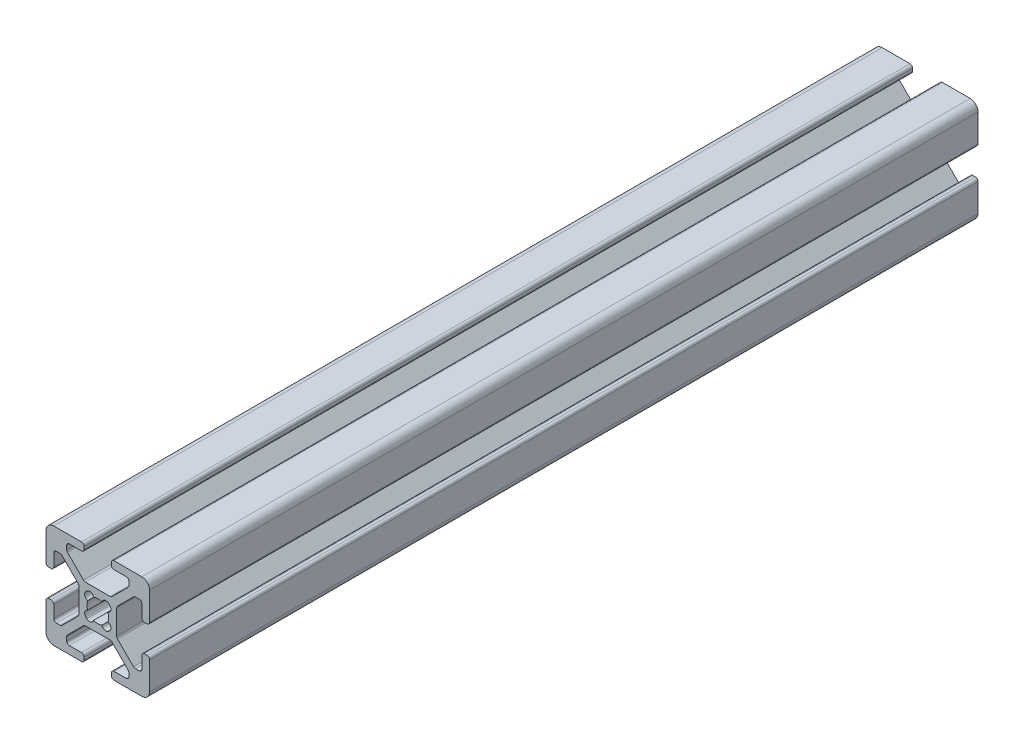
from build123d import *

# Parameters (mm, degrees)
BOSS_EXTRUDE1_DEPTH = 160


with BuildPart() as part:
    # Sketch1 → Boss-Extrude1 (new body)
    with BuildSketch(Plane(origin=(0, 0, -160), x_dir=(-1, 0, 0), z_dir=(0, 0, -1))):
        with BuildLine():
            Line((10, -8.5), (10, -3.138))
            ThreePointArc((10, -3.138), (9.851210245, -2.778789755), (9.492, -2.63))
            Line((9.492, -2.63), (9.008, -2.63))
            ThreePointArc((9.008, -2.63), (8.648789755, -2.778789755), (8.5, -3.138))
            Line((8.5, -3.138), (8.5, -5.487))
            ThreePointArc((8.5, -5.487), (8.351210245, -5.846210245), (7.992, -5.995))
            Line((7.992, -5.995), (7.26592049, -5.995))
            ThreePointArc((7.26592049, -5.995), (7.071517306, -5.956330803), (6.906710245, -5.846210245))
            Line((6.906710245, -5.846210245), (3.803789755, -2.743289755))
            ThreePointArc((3.803789755, -2.743289755), (3.693669197, -2.578482694), (3.655, -2.38407951))
            Line((3.655, -2.38407951), (3.655, 2.383759167))
            ThreePointArc((3.655, 2.383759167), (3.693669197, 2.57816235), (3.803789755, 2.742969412))
            Line((3.803789755, 2.742969412), (6.907030588, 5.846210245))
            ThreePointArc((6.907030588, 5.846210245), (7.07183765, 5.956330803), (7.266240833, 5.995))
            Line((7.266240833, 5.995), (7.992, 5.995))
            ThreePointArc((7.992, 5.995), (8.351210245, 5.846210245), (8.5, 5.487))
            Line((8.5, 5.487), (8.5, 3.138))
            ThreePointArc((8.5, 3.138), (8.648789755, 2.778789755), (9.008, 2.63))
            Line((9.008, 2.63), (9.492, 2.63))
            ThreePointArc((9.492, 2.63), (9.851210245, 2.778789755), (10, 3.138))
            Line((10, 3.138), (10, 8.5))
            ThreePointArc((10, 8.5), (9.560660172, 9.560660172), (8.5, 10))
            Line((8.5, 10), (3.138, 10))
            ThreePointArc((3.138, 10), (2.778789755, 9.851210245), (2.63, 9.492))
            Line((2.63, 9.492), (2.63, 9.008))
            ThreePointArc((2.63, 9.008), (2.778789755, 8.648789755), (3.138, 8.5))
            Line((3.138, 8.5), (5.487, 8.5))
            ThreePointArc((5.487, 8.5), (5.846210245, 8.351210245), (5.995, 7.992))
            Line((5.995, 7.992), (5.995, 7.26592049))
            ThreePointArc((5.995, 7.26592049), (5.956330803, 7.071517306), (5.846210245, 6.906710245))
            Line((5.846210245, 6.906710245), (2.743289755, 3.803789755))
            ThreePointArc((2.743289755, 3.803789755), (2.578482694, 3.693669197), (2.38407951, 3.655))
            Line((2.38407951, 3.655), (-2.383759167, 3.655))
            ThreePointArc((-2.383759167, 3.655), (-2.57816235, 3.693669197), (-2.742969412, 3.803789755))
            Line((-2.742969412, 3.803789755), (-5.846210245, 6.907030588))
            ThreePointArc((-5.846210245, 6.907030588), (-5.956330803, 7.07183765), (-5.995, 7.266240833))
            Line((-5.995, 7.266240833), (-5.995, 7.992))
            ThreePointArc((-5.995, 7.992), (-5.846210245, 8.351210245), (-5.487, 8.5))
            Line((-5.487, 8.5), (-3.138, 8.5))
            ThreePointArc((-3.138, 8.5), (-2.778789755, 8.648789755), (-2.63, 9.008))
            Line((-2.63, 9.008), (-2.63, 9.492))
            ThreePointArc((-2.63, 9.492), (-2.778789755, 9.851210245), (-3.138, 10))
            Line((-3.138, 10), (-8.5, 10))
            ThreePointArc((-8.5, 10), (-9.560660172, 9.560660172), (-10, 8.5))
            Line((-10, 8.5), (-10, 3.138))
            ThreePointArc((-10, 3.138), (-9.851210245, 2.778789755), (-9.492, 2.63))
            Line((-9.492, 2.63), (-9.008, 2.63))
            ThreePointArc((-9.008, 2.63), (-8.648789755, 2.778789755), (-8.5, 3.138))
            Line((-8.5, 3.138), (-8.5, 5.487))
            ThreePointArc((-8.5, 5.487), (-8.351210245, 5.846210245), (-7.992, 5.995))
            Line((-7.992, 5.995), (-7.26592049, 5.995))
            ThreePointArc((-7.26592049, 5.995), (-7.071517306, 5.956330803), (-6.906710245, 5.846210245))
            Line((-6.906710245, 5.846210245), (-3.803789755, 2.743289755))
            ThreePointArc((-3.803789755, 2.743289755), (-3.693669197, 2.578482694), (-3.655, 2.38407951))
            Line((-3.655, 2.38407951), (-3.655, -2.383759167))
            ThreePointArc((-3.655, -2.383759167), (-3.693669197, -2.57816235), (-3.803789755, -2.742969412))
            Line((-3.803789755, -2.742969412), (-6.907030588, -5.846210245))
            ThreePointArc((-6.907030588, -5.846210245), (-7.07183765, -5.956330803), (-7.266240833, -5.995))
            Line((-7.266240833, -5.995), (-7.992, -5.995))
            ThreePointArc((-7.992, -5.995), (-8.351210245, -5.846210245), (-8.5, -5.487))
            Line((-8.5, -5.487), (-8.5, -3.138))
            ThreePointArc((-8.5, -3.138), (-8.648789755, -2.778789755), (-9.008, -2.63))
            Line((-9.008, -2.63), (-9.492, -2.63))
            ThreePointArc((-9.492, -2.63), (-9.851210245, -2.778789755), (-10, -3.138))
            Line((-10, -3.138), (-10, -8.5))
            ThreePointArc((-10, -8.5), (-9.560660172, -9.560660172), (-8.5, -10))
            Line((-8.5, -10), (-3.138, -10))
            ThreePointArc((-3.138, -10), (-2.778789755, -9.851210245), (-2.63, -9.492))
            Line((-2.63, -9.492), (-2.63, -9.008))
            ThreePointArc((-2.63, -9.008), (-2.778789755, -8.648789755), (-3.138, -8.5))
            Line((-3.138, -8.5), (-5.487, -8.5))
            ThreePointArc((-5.487, -8.5), (-5.846210245, -8.351210245), (-5.995, -7.992))
            Line((-5.995, -7.992), (-5.995, -7.26592049))
            ThreePointArc((-5.995, -7.26592049), (-5.956330803, -7.071517306), (-5.846210245, -6.906710245))
            Line((-5.846210245, -6.906710245), (-2.743289755, -3.803789755))
            ThreePointArc((-2.743289755, -3.803789755), (-2.578482694, -3.693669197), (-2.38407951, -3.655))
            Line((-2.38407951, -3.655), (2.383759167, -3.655))
            ThreePointArc((2.383759167, -3.655), (2.57816235, -3.693669197), (2.742969412, -3.803789755))
            Line((2.742969412, -3.803789755), (5.846210245, -6.907030588))
            ThreePointArc((5.846210245, -6.907030588), (5.956330803, -7.07183765), (5.995, -7.266240833))
            Line((5.995, -7.266240833), (5.995, -7.992))
            ThreePointArc((5.995, -7.992), (5.846210245, -8.351210245), (5.487, -8.5))
            Line((5.487, -8.5), (3.138, -8.5))
            ThreePointArc((3.138, -8.5), (2.778789755, -8.648789755), (2.63, -9.008))
            Line((2.63, -9.008), (2.63, -9.492))
            ThreePointArc((2.63, -9.492), (2.778789755, -9.851210245), (3.138, -10))
            Line((3.138, -10), (8.5, -10))
            ThreePointArc((8.5, -10), (9.560660172, -9.560660172), (10, -8.5))
        make_face()
        with BuildLine():
            Line((2.304493037, -2.124493037), (2.124493037, -2.304493037))
            ThreePointArc((2.124493037, -2.304493037), (1.35638567, -2.506016078), (0.803729988, -1.935777391))
            ThreePointArc((0.803729988, -1.935777391), (0, -2.096), (-0.803729988, -1.935777391))
            ThreePointArc((-0.803729988, -1.935777391), (-1.35638567, -2.506016078), (-2.124493037, -2.304493037))
            Line((-2.124493037, -2.304493037), (-2.304493037, -2.124493037))
            ThreePointArc((-2.304493037, -2.124493037), (-2.506016078, -1.35638567), (-1.935777391, -0.803729988))
            ThreePointArc((-1.935777391, -0.803729988), (-2.096, 0), (-1.935777391, 0.803729988))
            ThreePointArc((-1.935777391, 0.803729988), (-2.506016078, 1.35638567), (-2.304493037, 2.124493037))
            Line((-2.304493037, 2.124493037), (-2.124493037, 2.304493037))
            ThreePointArc((-2.124493037, 2.304493037), (-1.35638567, 2.506016078), (-0.803729988, 1.935777391))
            ThreePointArc((-0.803729988, 1.935777391), (0, 2.096), (0.803729988, 1.935777391))
            ThreePointArc((0.803729988, 1.935777391), (1.35638567, 2.506016078), (2.124493037, 2.304493037))
            Line((2.124493037, 2.304493037), (2.304493037, 2.124493037))
            ThreePointArc((2.304493037, 2.124493037), (2.506016078, 1.35638567), (1.935777391, 0.803729988))
            ThreePointArc((1.935777391, 0.803729988), (2.096, 0), (1.935777391, -0.803729988))
            ThreePointArc((1.935777391, -0.803729988), (2.506016078, -1.35638567), (2.304493037, -2.124493037))
        make_face(mode=Mode.SUBTRACT)
    extrude(amount=-BOSS_EXTRUDE1_DEPTH)


solid = part.part
